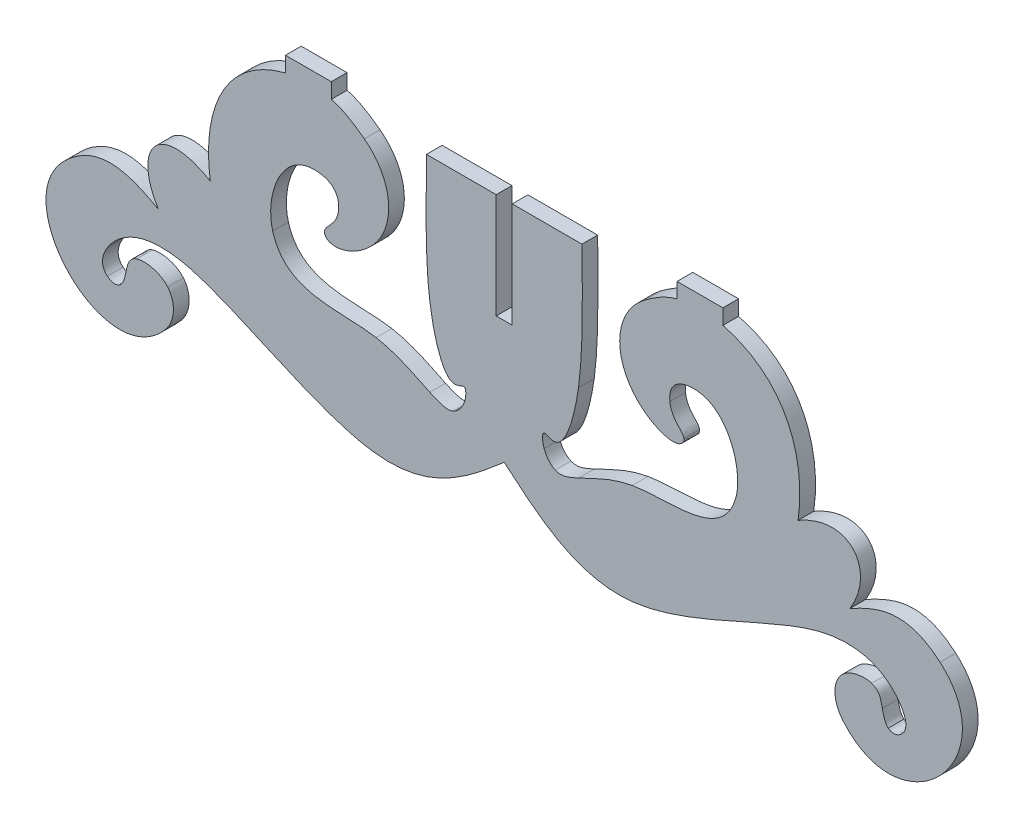
from build123d import *

# Parameters (mm, degrees)
RESSALTO_EXTRUS_O3_DEPTH = 2


with BuildPart() as part:
    # Model → Ressalto-extrusão3 (new body)
    with BuildSketch(Plane.XY):
        with BuildLine():
            Line((2.6823, 114.742), (2.6823, 128.1173))
            Line((2.6823, 128.1173), (-2.1377, 128.1173))
            Line((-2.1377, 128.1173), (-6.2057, 128.1173))
            add(Edge.make_bspline(
                [(-6.2057, 128.1173), (-6.2872, 122.1805), (-6.3375, 116.0426), (-5.7664, 112.0638)],
                knots=[0.040540541, 0.040540541, 0.040540541, 0.040540541, 0.054054054, 0.054054054, 0.054054054, 0.054054054], degree=3))
            add(Edge.make_bspline(
                [(-5.7664, 112.0638), (-5.1953, 108.0851), (-4.2478, 105.6627), (-3.3619, 104.8992)],
                knots=[0.054054054, 0.054054054, 0.054054054, 0.054054054, 0.067567568, 0.067567568, 0.067567568, 0.067567568], degree=3))
            add(Edge.make_bspline(
                [(-3.3619, 104.8992), (-2.476, 104.1357), (-1.6518, 105.031), (-1.3838, 104.874)],
                knots=[0.067567568, 0.067567568, 0.067567568, 0.067567568, 0.081081081, 0.081081081, 0.081081081, 0.081081081], degree=3))
            add(Edge.make_bspline(
                [(-1.3838, 104.874), (-1.1158, 104.7169), (-1.1279, 103.9092), (-1.3936, 103.1749)],
                knots=[0.081081081, 0.081081081, 0.081081081, 0.081081081, 0.094594595, 0.094594595, 0.094594595, 0.094594595], degree=3))
            add(Edge.make_bspline(
                [(-1.3936, 103.1749), (-1.6592, 102.4407), (-2.1785, 101.78), (-2.8073, 101.5081)],
                knots=[0.094594595, 0.094594595, 0.094594595, 0.094594595, 0.108108108, 0.108108108, 0.108108108, 0.108108108], degree=3))
            add(Edge.make_bspline(
                [(-2.8073, 101.5081), (-3.4361, 101.2363), (-4.1745, 101.3534), (-5.7653, 102.0982)],
                knots=[0.108108108, 0.108108108, 0.108108108, 0.108108108, 0.121621622, 0.121621622, 0.121621622, 0.121621622], degree=3))
            add(Edge.make_bspline(
                [(-5.7653, 102.0982), (-7.3562, 102.8428), (-9.7995, 104.2151), (-12.6058, 104.713)],
                knots=[0.121621622, 0.121621622, 0.121621622, 0.121621622, 0.135135135, 0.135135135, 0.135135135, 0.135135135], degree=3))
            add(Edge.make_bspline(
                [(-12.6058, 104.713), (-17.1488, 105.519), (-24.0882, 103.9546), (-25.7754, 109.8716)],
                knots=[0.135135135, 0.135135135, 0.135135135, 0.135135135, 0.148648649, 0.148648649, 0.148648649, 0.148648649], degree=3))
            add(Edge.make_bspline(
                [(-25.7754, 109.8716), (-26.7745, 113.3756), (-24.8277, 119.1922), (-20.6093, 119.2976)],
                knots=[0.148648649, 0.148648649, 0.148648649, 0.148648649, 0.162162162, 0.162162162, 0.162162162, 0.162162162], degree=3))
            add(Edge.make_bspline(
                [(-20.6093, 119.2976), (-18.663, 119.3462), (-17.1862, 118.4764), (-17.3974, 116.3585)],
                knots=[0.162162162, 0.162162162, 0.162162162, 0.162162162, 0.175675676, 0.175675676, 0.175675676, 0.175675676], degree=3))
            add(Edge.make_bspline(
                [(-17.3974, 116.3585), (-17.5799, 114.5287), (-19.0634, 113.9716), (-19.1837, 113.1767)],
                knots=[0.175675676, 0.175675676, 0.175675676, 0.175675676, 0.189189189, 0.189189189, 0.189189189, 0.189189189], degree=3))
            add(Edge.make_bspline(
                [(-19.1837, 113.1767), (-19.2528, 112.7207), (-18.8323, 112.2229), (-17.9925, 112.158)],
                knots=[0.189189189, 0.189189189, 0.189189189, 0.189189189, 0.202702703, 0.202702703, 0.202702703, 0.202702703], degree=3))
            add(Edge.make_bspline(
                [(-17.9925, 112.158), (-17.1526, 112.0932), (-15.8934, 112.4613), (-14.6869, 113.265)],
                knots=[0.202702703, 0.202702703, 0.202702703, 0.202702703, 0.216216216, 0.216216216, 0.216216216, 0.216216216], degree=3))
            add(Edge.make_bspline(
                [(-14.6869, 113.265), (-10.0229, 116.3715), (-9.7672, 122.5736), (-14.1156, 125.881)],
                knots=[0.216216216, 0.216216216, 0.216216216, 0.216216216, 0.22972973, 0.22972973, 0.22972973, 0.22972973], degree=3))
            add(Edge.make_bspline(
                [(-14.1156, 125.881), (-15.2489, 126.743), (-16.7519, 127.7519), (-18.3132, 128.1252)],
                knots=[0.22972973, 0.22972973, 0.22972973, 0.22972973, 0.243243243, 0.243243243, 0.243243243, 0.243243243], degree=3))
            Line((-18.3132, 128.1252), (-18.3132, 130.0761))
            Line((-18.3132, 130.0761), (-24.1465, 130.0761))
            Line((-24.1465, 130.0761), (-24.1465, 128.1252))
            add(Edge.make_bspline(
                [(-24.1465, 128.1252), (-32.0728, 126.0952), (-34.8065, 118.857), (-33.7182, 111.4167)],
                knots=[0.283783784, 0.283783784, 0.283783784, 0.283783784, 0.297297297, 0.297297297, 0.297297297, 0.297297297], degree=3))
            add(Edge.make_bspline(
                [(-33.7182, 111.4167), (-40.2193, 115.1974), (-43.7624, 110.6088), (-40.3391, 105.0184)],
                knots=[0.297297297, 0.297297297, 0.297297297, 0.297297297, 0.310810811, 0.310810811, 0.310810811, 0.310810811], degree=3))
            add(Edge.make_bspline(
                [(-40.3391, 105.0184), (-43.641, 106.7993), (-47.4419, 108.6172), (-51.8067, 104.8092)],
                knots=[0.310810811, 0.310810811, 0.310810811, 0.310810811, 0.324324324, 0.324324324, 0.324324324, 0.324324324], degree=3))
            add(Edge.make_bspline(
                [(-51.8067, 104.8092), (-60.4961, 97.2284), (-47.1112, 83.2416), (-39.4697, 92.1461)],
                knots=[0.324324324, 0.324324324, 0.324324324, 0.324324324, 0.337837838, 0.337837838, 0.337837838, 0.337837838], degree=3))
            add(Edge.make_bspline(
                [(-39.4697, 92.1461), (-38.0901, 93.7537), (-38.1508, 95.8393), (-39.1413, 97.0212)],
                knots=[0.337837838, 0.337837838, 0.337837838, 0.337837838, 0.351351351, 0.351351351, 0.351351351, 0.351351351], degree=3))
            add(Edge.make_bspline(
                [(-39.1413, 97.0212), (-40.1318, 98.2031), (-42.052, 98.4813), (-43.0896, 98.1476)],
                knots=[0.351351351, 0.351351351, 0.351351351, 0.351351351, 0.364864865, 0.364864865, 0.364864865, 0.364864865], degree=3))
            add(Edge.make_bspline(
                [(-43.0896, 98.1476), (-44.1272, 97.814), (-44.2821, 96.8684), (-44.4469, 96.0633)],
                knots=[0.364864865, 0.364864865, 0.364864865, 0.364864865, 0.378378378, 0.378378378, 0.378378378, 0.378378378], degree=3))
            add(Edge.make_bspline(
                [(-44.4469, 96.0633), (-44.6116, 95.2582), (-44.7862, 94.5935), (-45.1953, 94.252)],
                knots=[0.378378378, 0.378378378, 0.378378378, 0.378378378, 0.391891892, 0.391891892, 0.391891892, 0.391891892], degree=3))
            add(Edge.make_bspline(
                [(-45.1953, 94.252), (-45.6043, 93.9105), (-46.2477, 93.8921), (-46.8277, 94.3876)],
                knots=[0.391891892, 0.391891892, 0.391891892, 0.391891892, 0.405405405, 0.405405405, 0.405405405, 0.405405405], degree=3))
            add(Edge.make_bspline(
                [(-46.8277, 94.3876), (-47.4077, 94.8831), (-47.9242, 95.8925), (-46.7036, 97.7025)],
                knots=[0.405405405, 0.405405405, 0.405405405, 0.405405405, 0.418918919, 0.418918919, 0.418918919, 0.418918919], degree=3))
            add(Edge.make_bspline(
                [(-46.7036, 97.7025), (-45.4829, 99.5125), (-42.525, 102.1232), (-36.2036, 100.4665)],
                knots=[0.418918919, 0.418918919, 0.418918919, 0.418918919, 0.432432432, 0.432432432, 0.432432432, 0.432432432], degree=3))
            add(Edge.make_bspline(
                [(-36.2036, 100.4665), (-29.8822, 98.8098), (-20.1973, 92.8857), (-12.9869, 91.9486)],
                knots=[0.432432432, 0.432432432, 0.432432432, 0.432432432, 0.445945946, 0.445945946, 0.445945946, 0.445945946], degree=3))
            add(Edge.make_bspline(
                [(-12.9869, 91.9486), (-5.7764, 91.0116), (-1.0404, 95.0614), (3.6956, 99.1113)],
                knots=[0.445945946, 0.445945946, 0.445945946, 0.445945946, 0.459459459, 0.459459459, 0.459459459, 0.459459459], degree=3))
            add(Edge.make_bspline(
                [(3.6956, 99.1113), (8.4316, 95.0614), (13.1676, 91.0116), (20.3781, 91.9486)],
                knots=[0.459459459, 0.459459459, 0.459459459, 0.459459459, 0.472972973, 0.472972973, 0.472972973, 0.472972973], degree=3))
            add(Edge.make_bspline(
                [(20.3781, 91.9486), (27.5885, 92.8857), (37.2734, 98.8098), (43.5948, 100.4665)],
                knots=[0.472972973, 0.472972973, 0.472972973, 0.472972973, 0.486486486, 0.486486486, 0.486486486, 0.486486486], degree=3))
            add(Edge.make_bspline(
                [(43.5948, 100.4665), (49.9162, 102.1232), (52.8741, 99.5125), (54.0948, 97.7025)],
                knots=[0.486486486, 0.486486486, 0.486486486, 0.486486486, 0.5, 0.5, 0.5, 0.5], degree=3))
            add(Edge.make_bspline(
                [(54.0948, 97.7025), (55.3154, 95.8925), (54.7988, 94.8831), (54.2189, 94.3876)],
                knots=[0.5, 0.5, 0.5, 0.5, 0.513513514, 0.513513514, 0.513513514, 0.513513514], degree=3))
            add(Edge.make_bspline(
                [(54.2189, 94.3876), (53.6389, 93.8921), (52.9955, 93.9105), (52.5865, 94.252)],
                knots=[0.513513514, 0.513513514, 0.513513514, 0.513513514, 0.527027027, 0.527027027, 0.527027027, 0.527027027], degree=3))
            add(Edge.make_bspline(
                [(52.5865, 94.252), (52.1774, 94.5935), (52.0028, 95.2582), (51.838, 96.0633)],
                knots=[0.527027027, 0.527027027, 0.527027027, 0.527027027, 0.540540541, 0.540540541, 0.540540541, 0.540540541], degree=3))
            add(Edge.make_bspline(
                [(51.838, 96.0633), (51.6733, 96.8684), (51.5184, 97.814), (50.4808, 98.1476)],
                knots=[0.540540541, 0.540540541, 0.540540541, 0.540540541, 0.554054054, 0.554054054, 0.554054054, 0.554054054], degree=3))
            add(Edge.make_bspline(
                [(50.4808, 98.1476), (49.4432, 98.4813), (47.5229, 98.2031), (46.5324, 97.0212)],
                knots=[0.554054054, 0.554054054, 0.554054054, 0.554054054, 0.567567568, 0.567567568, 0.567567568, 0.567567568], degree=3))
            add(Edge.make_bspline(
                [(46.5324, 97.0212), (45.5419, 95.8393), (45.4813, 93.7537), (46.8609, 92.1461)],
                knots=[0.567567568, 0.567567568, 0.567567568, 0.567567568, 0.581081081, 0.581081081, 0.581081081, 0.581081081], degree=3))
            add(Edge.make_bspline(
                [(46.8609, 92.1461), (54.5024, 83.2416), (67.8873, 97.2284), (59.1979, 104.8092)],
                knots=[0.581081081, 0.581081081, 0.581081081, 0.581081081, 0.594594595, 0.594594595, 0.594594595, 0.594594595], degree=3))
            add(Edge.make_bspline(
                [(59.1979, 104.8092), (54.8331, 108.6172), (51.0322, 106.7993), (47.7303, 105.0184)],
                knots=[0.594594595, 0.594594595, 0.594594595, 0.594594595, 0.608108108, 0.608108108, 0.608108108, 0.608108108], degree=3))
            add(Edge.make_bspline(
                [(47.7303, 105.0184), (51.1536, 110.6088), (47.6105, 115.1974), (41.1094, 111.4167)],
                knots=[0.608108108, 0.608108108, 0.608108108, 0.608108108, 0.621621622, 0.621621622, 0.621621622, 0.621621622], degree=3))
            add(Edge.make_bspline(
                [(41.1094, 111.4167), (42.1976, 118.857), (39.464, 126.0952), (31.5377, 128.1252)],
                knots=[0.621621622, 0.621621622, 0.621621622, 0.621621622, 0.635135135, 0.635135135, 0.635135135, 0.635135135], degree=3))
            Line((31.5377, 128.1252), (31.5377, 130.0651))
            Line((31.5377, 130.0651), (25.7044, 130.0651))
            Line((25.7044, 130.0651), (25.7044, 128.1252))
            add(Edge.make_bspline(
                [(25.7044, 128.1252), (24.143, 127.7519), (22.6401, 126.743), (21.5068, 125.881)],
                knots=[0.675675676, 0.675675676, 0.675675676, 0.675675676, 0.689189189, 0.689189189, 0.689189189, 0.689189189], degree=3))
            add(Edge.make_bspline(
                [(21.5068, 125.881), (17.1584, 122.5736), (17.4141, 116.3715), (22.078, 113.265)],
                knots=[0.689189189, 0.689189189, 0.689189189, 0.689189189, 0.702702703, 0.702702703, 0.702702703, 0.702702703], degree=3))
            add(Edge.make_bspline(
                [(22.078, 113.265), (23.2846, 112.4613), (24.5438, 112.0932), (25.3837, 112.158)],
                knots=[0.702702703, 0.702702703, 0.702702703, 0.702702703, 0.716216216, 0.716216216, 0.716216216, 0.716216216], degree=3))
            add(Edge.make_bspline(
                [(25.3837, 112.158), (26.2235, 112.2229), (26.6439, 112.7207), (26.5749, 113.1767)],
                knots=[0.716216216, 0.716216216, 0.716216216, 0.716216216, 0.72972973, 0.72972973, 0.72972973, 0.72972973], degree=3))
            add(Edge.make_bspline(
                [(26.5749, 113.1767), (26.4546, 113.9716), (24.9711, 114.5287), (24.7886, 116.3585)],
                knots=[0.72972973, 0.72972973, 0.72972973, 0.72972973, 0.743243243, 0.743243243, 0.743243243, 0.743243243], degree=3))
            add(Edge.make_bspline(
                [(24.7886, 116.3585), (24.5774, 118.4764), (26.0542, 119.3462), (28.0005, 119.2976)],
                knots=[0.743243243, 0.743243243, 0.743243243, 0.743243243, 0.756756757, 0.756756757, 0.756756757, 0.756756757], degree=3))
            add(Edge.make_bspline(
                [(28.0005, 119.2976), (32.2189, 119.1922), (34.1657, 113.3756), (33.1666, 109.8716)],
                knots=[0.756756757, 0.756756757, 0.756756757, 0.756756757, 0.77027027, 0.77027027, 0.77027027, 0.77027027], degree=3))
            add(Edge.make_bspline(
                [(33.1666, 109.8716), (31.4794, 103.9546), (24.54, 105.519), (19.9969, 104.713)],
                knots=[0.77027027, 0.77027027, 0.77027027, 0.77027027, 0.783783784, 0.783783784, 0.783783784, 0.783783784], degree=3))
            add(Edge.make_bspline(
                [(19.9969, 104.713), (17.1907, 104.2151), (14.7474, 102.8428), (13.1565, 102.0982)],
                knots=[0.783783784, 0.783783784, 0.783783784, 0.783783784, 0.797297297, 0.797297297, 0.797297297, 0.797297297], degree=3))
            add(Edge.make_bspline(
                [(13.1565, 102.0982), (11.5657, 101.3534), (10.8273, 101.2363), (10.1985, 101.5081)],
                knots=[0.797297297, 0.797297297, 0.797297297, 0.797297297, 0.810810811, 0.810810811, 0.810810811, 0.810810811], degree=3))
            add(Edge.make_bspline(
                [(10.1985, 101.5081), (9.5697, 101.78), (9.0504, 102.4407), (8.7847, 103.1749)],
                knots=[0.810810811, 0.810810811, 0.810810811, 0.810810811, 0.824324324, 0.824324324, 0.824324324, 0.824324324], degree=3))
            add(Edge.make_bspline(
                [(8.7847, 103.1749), (8.5191, 103.9092), (8.507, 104.7169), (8.775, 104.874)],
                knots=[0.824324324, 0.824324324, 0.824324324, 0.824324324, 0.837837838, 0.837837838, 0.837837838, 0.837837838], degree=3))
            add(Edge.make_bspline(
                [(8.775, 104.874), (9.043, 105.031), (9.8672, 104.1357), (10.7531, 104.8992)],
                knots=[0.837837838, 0.837837838, 0.837837838, 0.837837838, 0.851351351, 0.851351351, 0.851351351, 0.851351351], degree=3))
            add(Edge.make_bspline(
                [(10.7531, 104.8992), (11.639, 105.6627), (12.5865, 108.0851), (13.1576, 112.0638)],
                knots=[0.851351351, 0.851351351, 0.851351351, 0.851351351, 0.864864865, 0.864864865, 0.864864865, 0.864864865], degree=3))
            add(Edge.make_bspline(
                [(13.1576, 112.0638), (13.7287, 116.0426), (13.6784, 122.1805), (13.5969, 128.1173)],
                knots=[0.864864865, 0.864864865, 0.864864865, 0.864864865, 0.878378378, 0.878378378, 0.878378378, 0.878378378], degree=3))
            Line((13.5969, 128.1173), (9.529, 128.1173))
            Line((9.529, 128.1173), (4.7156, 128.1173))
            Line((4.7156, 128.1173), (4.7156, 114.742))
            Line((4.7156, 114.742), (4.6856, 114.742))
            Line((4.6856, 114.742), (2.7124, 114.742))
            Line((2.7124, 114.742), (2.6823, 114.742))
        make_face()
    extrude(amount=RESSALTO_EXTRUS_O3_DEPTH)


solid = part.part
